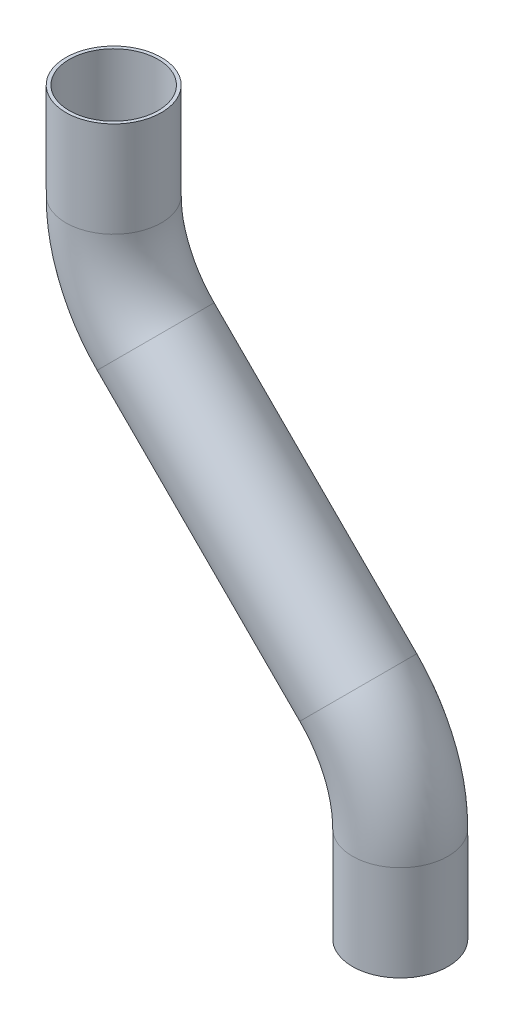
from build123d import *

# Parameters (mm, degrees)
SKETCH1_R   = 12.7
SKETCH1_R_2 = 11.811


with BuildPart() as part:
    # Sweep1: sweep along a path in Sketch2
    with BuildLine(Plane.XY) as sweep1_path:
        Line((0, 0), (0, 25.4))
        ThreePointArc((0, 25.4), (-2.900189811, 39.980238773), (-11.159231637, 52.340768363))
        Line((-11.159231637, 52.340768363), (-65.040768363, 106.22230509))
        ThreePointArc((-65.040768363, 106.22230509), (-73.299810189, 118.58283468), (-76.2, 133.163073453))
        Line((-76.2, 133.163073453), (-76.2, 158.563073453))
    # Sketch1 → Sweep1 (sweep)
    with BuildSketch(Plane(origin=(0, 0, 0), x_dir=(1, 0, 0), z_dir=(0, 1, 0))):
        Circle(SKETCH1_R)
        Circle(SKETCH1_R_2, mode=Mode.SUBTRACT)
    sweep(path=sweep1_path.line)


solid = part.part
